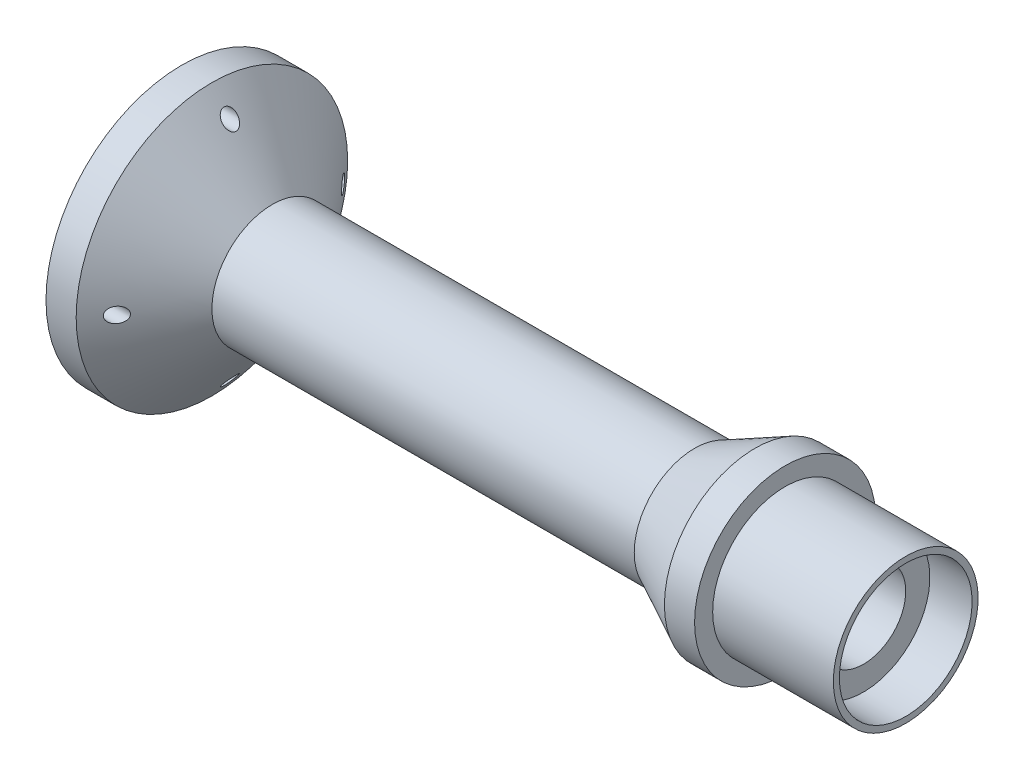
from build123d import *

# Parameters (mm, degrees)
IZIM3_R                 = 1.25
KES_EKSTR_ZYON1_DEPTH   = 10
DAIRESEL_KAPLAMA2_COUNT = 4


with BuildPart() as part:
    # Çizim2 → Döndür1 (revolve)
    with BuildSketch(Plane.XY, mode=Mode.PRIVATE) as d_nd_r1_sk:
        Polygon((-14.222748097, 7), (98.777251903, 7), (98.777251903, 11), (105.777251903, 11), (105.777251903, 12), (85.777251903, 12), (85.777251903, 15), (80.777251903, 15), (70.777251903, 10), (0.777251903, 10), (-9.222748097, 22.5), (-14.222748097, 22.5), align=None)
    revolve(d_nd_r1_sk.sketch.rotate(Axis((0, 0, 0), (1, 0, 0)), 90), axis=Axis((0, 0, 0), (1, 0, 0)))

    # Çizim3 → Kes-Ekstrüzyon1 (cut)
    with BuildSketch(Plane.ZY.offset(14.222748097)):
        with Locations((0, 18.75)):
            Circle(IZIM3_R)
    kes_ekstr_zyon1 = extrude(amount=-KES_EKSTR_ZYON1_DEPTH, mode=Mode.SUBTRACT)

    # Dairesel Kaplama2: Kes-Ekstrüzyon1 ×4 about axis
    dairesel_kaplama2_axis = Axis((0, 0, 0), (1, 0, 0))
    for i in range(1, DAIRESEL_KAPLAMA2_COUNT):
        add(kes_ekstr_zyon1.rotate(dairesel_kaplama2_axis, i * 360 / DAIRESEL_KAPLAMA2_COUNT), mode=Mode.SUBTRACT)


solid = part.part
